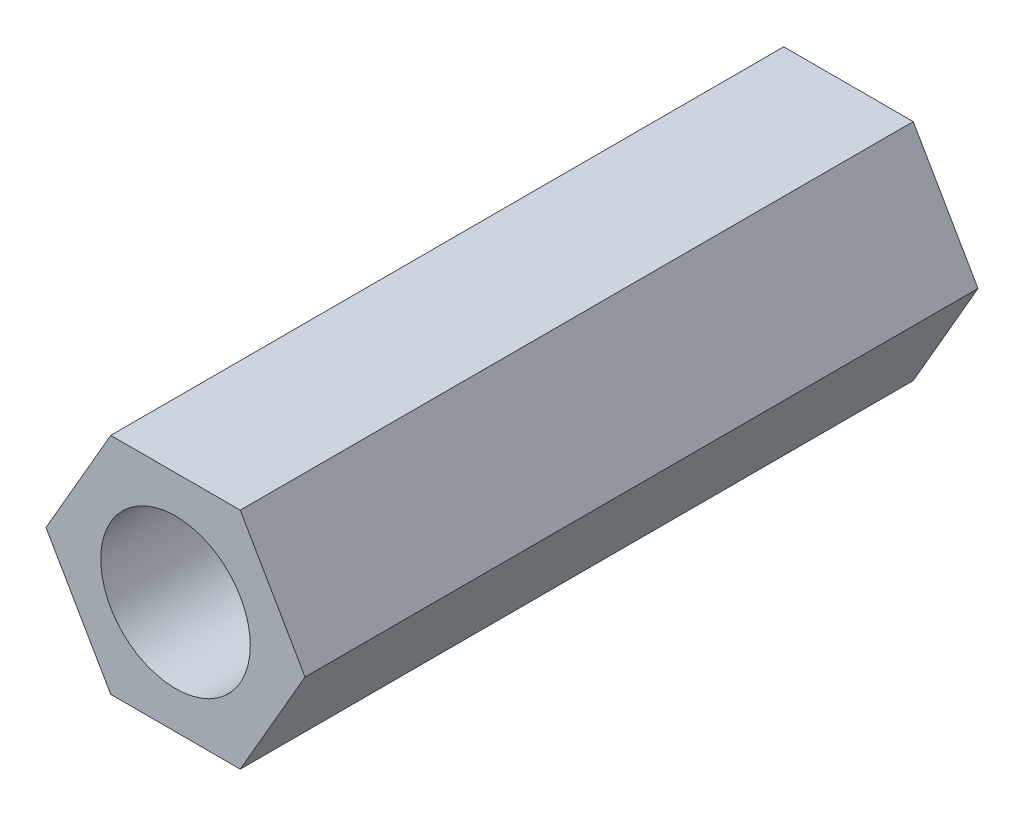
from build123d import *

# Parameters (mm, degrees)
SKETCH_1_R      = 1
EXTRUDE_1_DEPTH = 9


with BuildPart() as part:
    # 草图1 → 凸台-拉伸1 (new body)
    with BuildSketch(Plane.XY):
        Polygon((1.732050808, 0), (0.866025404, 1.5), (-0.866025404, 1.5), (-1.732050808, 0), (-0.866025404, -1.5), (0.866025404, -1.5), align=None)
        Circle(SKETCH_1_R, mode=Mode.SUBTRACT)
    extrude(amount=EXTRUDE_1_DEPTH)


solid = part.part
